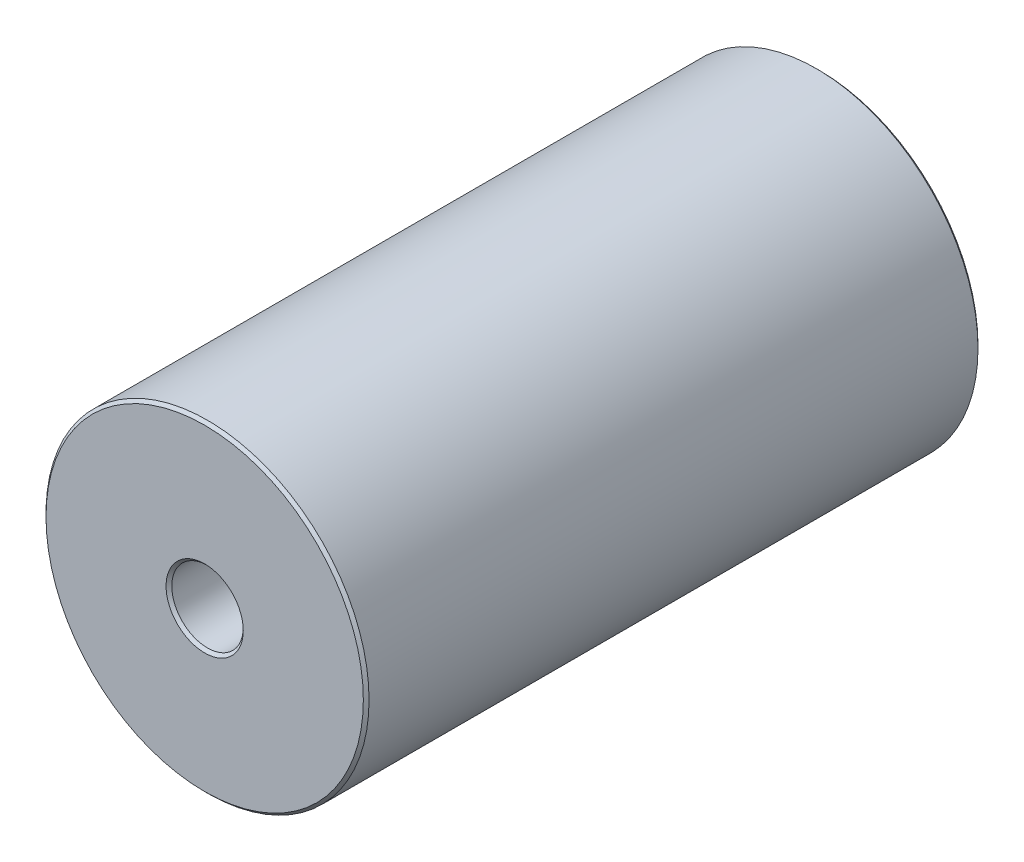
from build123d import *

# Parameters (mm, degrees)
SKETCH1_R           = 14.351
SKETCH1_R_2         = 3.175
BOSS_EXTRUDE1_DEPTH = 54.61
CHAMFER1_SIZE       = 0.254


with BuildPart() as part:
    # Sketch1 → Boss-Extrude1 (new body)
    with BuildSketch(Plane.XY):
        Circle(SKETCH1_R)
        Circle(SKETCH1_R_2, mode=Mode.SUBTRACT)
    extrude(amount=BOSS_EXTRUDE1_DEPTH)

    # Chamfer1
    chamfer1_edges = [part.edges().sort_by_distance(p)[0] for p in [
        (-14.351, 0, 0),
        (-14.351, 0, 54.61),
        (-3.175, 0, 0),
        (-3.175, 0, 54.61),
    ]]
    chamfer(chamfer1_edges, length=CHAMFER1_SIZE)


solid = part.part
